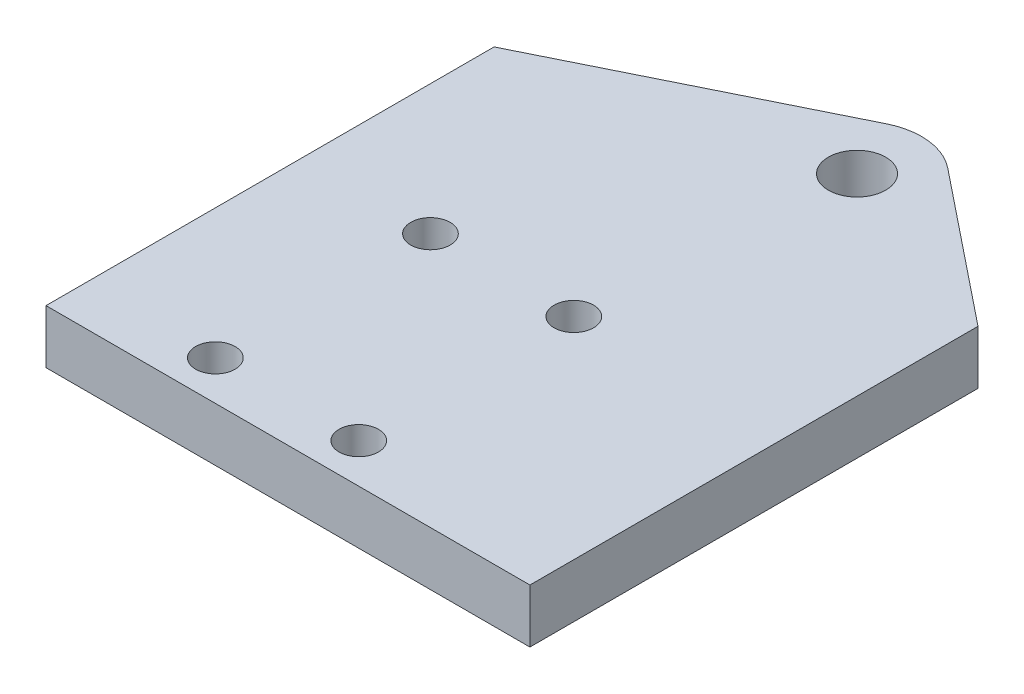
from build123d import *
from build123d.topology import SkipClean

# Parameters (mm, degrees)
SKETCH_2_R      = 1.1
SKETCH_2_R_2    = 1.6
EXTRUDE_1_DEPTH = 3
EXTRUDE_START   = 3
SKETCH_3_R      = 1.6
EXTRUDE_2_DEPTH = 3


with BuildPart() as part:
    # 草图2 → 凸台-拉伸1 (new body)
    with BuildSketch(Plane(origin=(0, 0, 0), x_dir=(1, 0, 0), z_dir=(0, 1, 0))):
        with BuildLine():
            Line((0, 0), (27, 0))
            Line((27, 0), (27, 25))
            Line((27, 25), (18.500967228, 31.809474424))
            ThreePointArc((18.500967228, 31.809474424), (16.640386089, 32.578770557), (14.657701498, 32.228712666))
            Line((14.657701498, 32.228712666), (0, 25))
            Line((0, 25), (0, 0))
        make_face()
        with Locations(Location((7.25, 14.2, 0), (0, 0, 270))):
            Circle(SKETCH_2_R, mode=Mode.SUBTRACT)
        with Locations(Location((15.25, 14.2, 0), (0, 0, 90))):
            Circle(SKETCH_2_R, mode=Mode.SUBTRACT)
        with Locations(Location((15.25, 2.2, 0), (0, 0, 270))):
            Circle(SKETCH_2_R, mode=Mode.SUBTRACT)
        with Locations(Location((7.25, 2.2, 0), (0, 0, 90))):
            Circle(SKETCH_2_R, mode=Mode.SUBTRACT)
        with Locations(Location((16.25, 29, 0), (0, 0, 270))):
            Circle(SKETCH_2_R_2, mode=Mode.SUBTRACT)
    extrude(amount=EXTRUDE_1_DEPTH)

    # 草图3 → 凸台-拉伸2 (add)
    with SkipClean():  # the faces are left unmerged after this step: merging them gives an invalid solid
        with BuildSketch(Plane.XZ.offset(EXTRUDE_START)):
            with BuildLine():
                Line((19.744057368, -30.813503383), (18.500967228, -31.809474424))
                ThreePointArc((18.500967228, -31.809474424), (16.640386089, -32.578770557), (14.657701498, -32.228712666))
                Line((14.657701498, -32.228712666), (1.744057368, -25.860113681))
                Line((1.744057368, -25.860113681), (1.744057368, -18))
                Line((1.744057368, -18), (19.744057368, -18))
                Line((19.744057368, -18), (19.744057368, -30.813503383))
            make_face()
            with Locations(Location((16.25, -29, 0), (0, 0, 270))):
                Circle(SKETCH_3_R, mode=Mode.SUBTRACT)
        extrude(amount=-EXTRUDE_2_DEPTH)


solid = part.part
